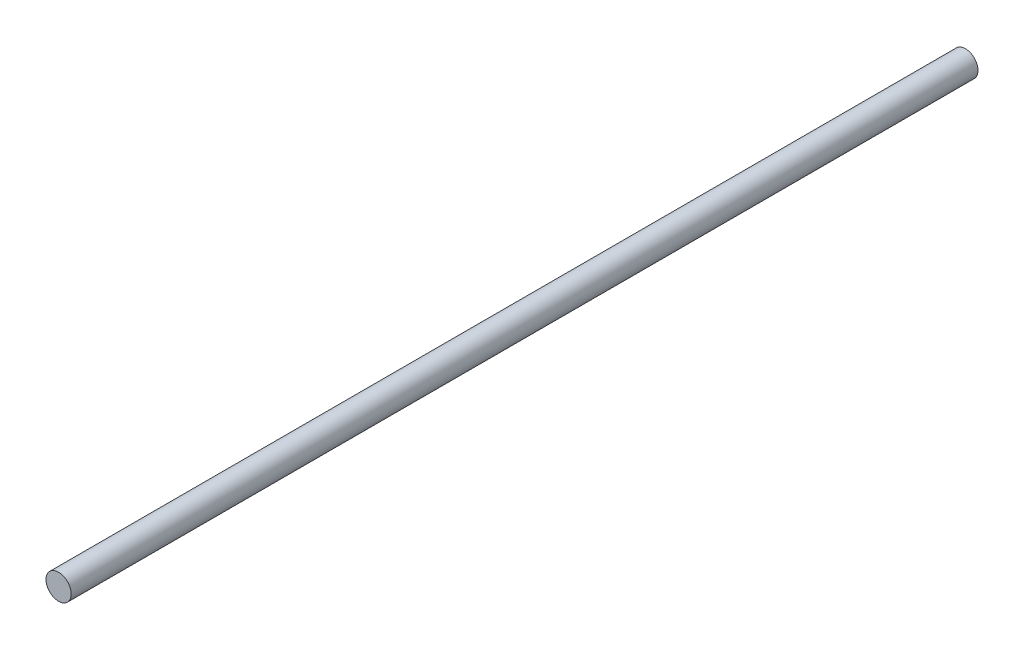
from build123d import *

# Parameters (mm, degrees)
SKETCH1_W = 1
SKETCH1_H = 72


with BuildPart() as part:
    # Sketch1 → Revolve1 (revolve)
    with BuildSketch(Plane(origin=(0, 0, 0), x_dir=(1, 0, 0), z_dir=(0, 1, 0))):
        with Locations((0.5, 36)):
            Rectangle(SKETCH1_W, SKETCH1_H)
    revolve(axis=Axis((0, 0, 0), (0, 0, -1)))


solid = part.part
